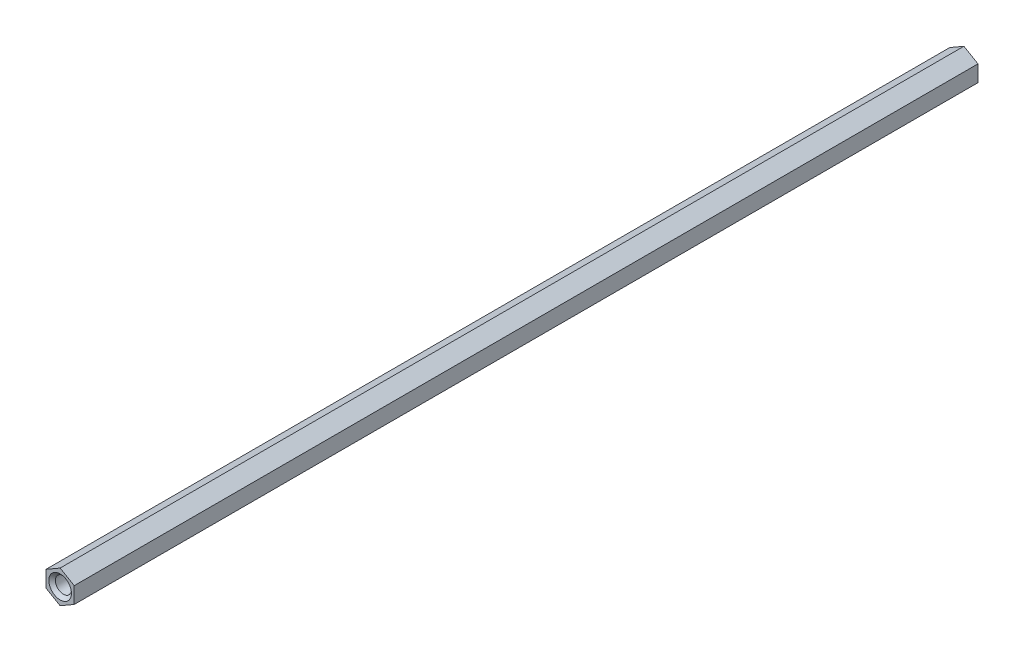
from build123d import *

# Parameters (mm, degrees)
BOSS_EXTRUDE1_DEPTH               = 152.4
F_1_4_28_TAPPED_HOLE1_D           = 5.4102
F_1_4_28_TAPPED_HOLE1_DEPTH       = 15.24
F_1_4_28_TAPPED_HOLE1_CSINK_D     = 7.62
F_1_4_28_TAPPED_HOLE1_CSINK_ANGLE = 90
F_1_4_28_TAPPED_HOLE1_TIP         = 1.625388061
F_1_4_28_TAPPED_HOLE2_D           = 5.4102
F_1_4_28_TAPPED_HOLE2_DEPTH       = 17.2339
F_1_4_28_TAPPED_HOLE2_CSINK_D     = 7.62
F_1_4_28_TAPPED_HOLE2_CSINK_ANGLE = 90
F_1_4_28_TAPPED_HOLE2_TIP         = 1.625388061


with BuildPart() as part:
    # Sketch3 → Boss-Extrude1 (new, symmetric)
    with BuildSketch(Plane.XY):
        Polygon((0, 5.499261314), (4.7625, 2.749630657), (4.7625, -2.749630657), (0, -5.499261314), (-4.7625, -2.749630657), (-4.7625, 2.749630657), align=None)
    extrude(amount=BOSS_EXTRUDE1_DEPTH, both=True)

    # 1/4-28 Tapped Hole1
    with Locations(Plane.XY.offset(152.4)):
        with Locations((0, 0)):
            CounterSinkHole(F_1_4_28_TAPPED_HOLE1_D / 2, F_1_4_28_TAPPED_HOLE1_CSINK_D / 2, depth=F_1_4_28_TAPPED_HOLE1_DEPTH, counter_sink_angle=F_1_4_28_TAPPED_HOLE1_CSINK_ANGLE)
            with Locations((0, 0, -(F_1_4_28_TAPPED_HOLE1_DEPTH + F_1_4_28_TAPPED_HOLE1_TIP / 2))):  # 118° drill point
                Cone(0, F_1_4_28_TAPPED_HOLE1_D / 2, F_1_4_28_TAPPED_HOLE1_TIP, mode=Mode.SUBTRACT)

    # 1/4-28 Tapped Hole2
    with Locations(Plane(origin=(0, 0, -152.4), x_dir=(-1, 0, 0), z_dir=(0, 0, -1))):
        with Locations((0, 0)):
            CounterSinkHole(F_1_4_28_TAPPED_HOLE2_D / 2, F_1_4_28_TAPPED_HOLE2_CSINK_D / 2, depth=F_1_4_28_TAPPED_HOLE2_DEPTH, counter_sink_angle=F_1_4_28_TAPPED_HOLE2_CSINK_ANGLE)
            with Locations((0, 0, -(F_1_4_28_TAPPED_HOLE2_DEPTH + F_1_4_28_TAPPED_HOLE2_TIP / 2))):  # 118° drill point
                Cone(0, F_1_4_28_TAPPED_HOLE2_D / 2, F_1_4_28_TAPPED_HOLE2_TIP, mode=Mode.SUBTRACT)


solid = part.part
